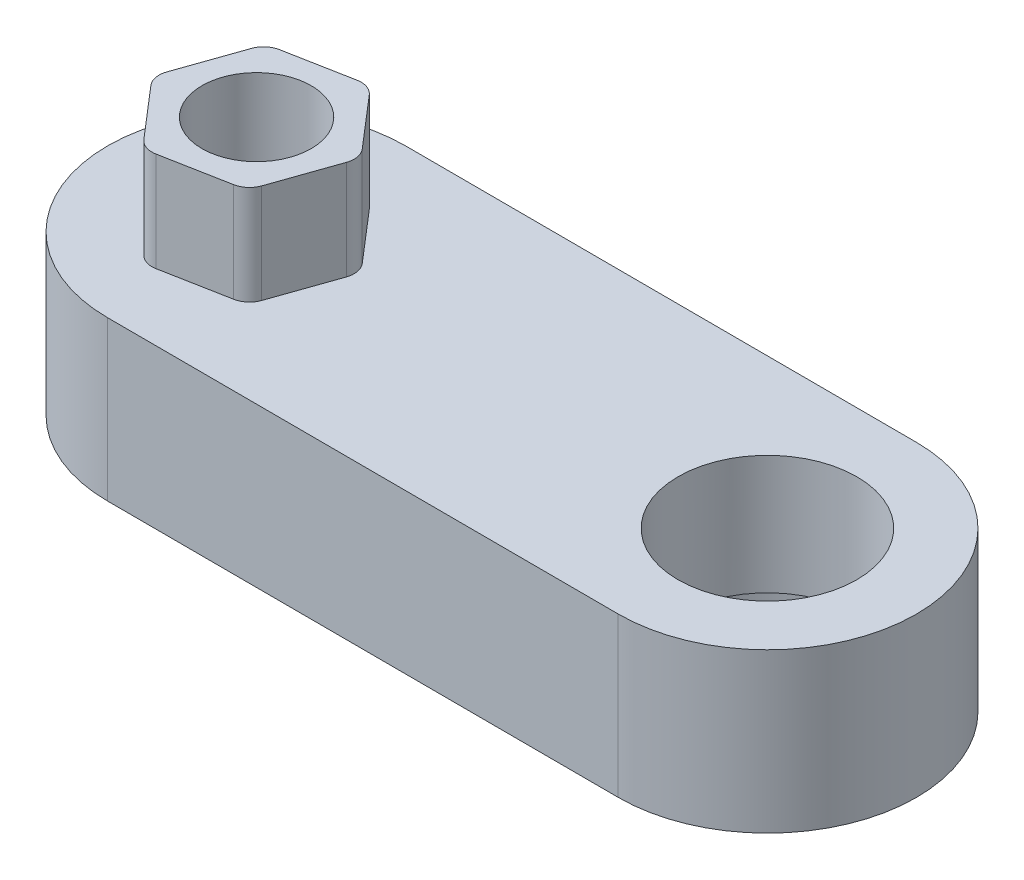
from build123d import *

# Parameters (mm, degrees)
BOSS_EXTRUDE1_DEPTH = 8
BOSS_EXTRUDE2_DEPTH = 5
SKETCH3_R           = 2.75
CUT_EXTRUDE1_DEPTH  = 36.813646862
FILLET1_R           = 1
CUT_EXTRUDE2_DEPTH  = 3
SKETCH5_R           = 6.6
CUT_EXTRUDE3_DEPTH  = 2
SKETCH6_R           = 4.5
CUT_EXTRUDE4_DEPTH  = 36.137121418


with BuildPart() as part:
    # Sketch1 → Boss-Extrude1 (new body)
    with BuildSketch(Plane(origin=(0, 0, 0), x_dir=(1, 0, 0), z_dir=(0, 1, 0))):
        with BuildLine():
            Line((24.015632569, -4.149601491), (-1.78233066, -4.083471877))
            ThreePointArc((-1.78233066, -4.083471877), (-9.26308084, 3.435728662), (-1.743880301, 10.916478842))
            Line((-1.743880301, 10.916478842), (24.054082929, 10.850349227))
            ThreePointArc((24.054082929, 10.850349227), (31.534833108, 3.331148688), (24.015632569, -4.149601491))
        make_face()
    extrude(amount=BOSS_EXTRUDE1_DEPTH)

    # Sketch2 → Boss-Extrude2 (add)
    with BuildSketch(Plane(origin=(0, 8, 0), x_dir=(1, 0, 0), z_dir=(0, 1, 0))):
        Polygon((-3.25175247, -0.833664766), (1.173324698, 0.002213248), (2.661971688, 4.252381497), (-0.274458491, 7.666671731), (-4.69953566, 6.830793717), (-6.188182649, 2.580625468), align=None)
    extrude(amount=BOSS_EXTRUDE2_DEPTH)

    # Sketch3 → Cut-Extrude1 (cut, through all)
    with BuildSketch(Plane(origin=(0, 13, 0), x_dir=(1, 0, 0), z_dir=(0, 1, 0))):
        with Locations(Location((-1.763105481, 3.416503482, 0), (0, 0, 270))):
            Circle(SKETCH3_R)
    extrude(amount=-CUT_EXTRUDE1_DEPTH, mode=Mode.SUBTRACT)

    # Fillet1
    fillet1_edges = [part.edges().sort_by_distance(p)[0] for p in [
        (-6.188182649, 10.5, -2.580625468),
        (-3.25175247, 10.5, 0.833664766),
        (1.173324698, 10.5, -0.002213248),
        (2.661971688, 10.5, -4.252381497),
        (-0.274458491, 10.5, -7.666671731),
        (-4.69953566, 10.5, -6.830793717),
    ]]
    fillet(fillet1_edges, radius=FILLET1_R)

    # Sketch4 → Cut-Extrude2 (cut)
    with BuildSketch(Plane.XZ):
        with BuildLine():
            Line((2.943011006, -3.542205297), (1.836068373, -0.381823779))
            ThreePointArc((1.836068373, -0.381823779), (1.398479703, 0.259582363), (0.698813727, 0.596262041))
            Line((0.698813727, 0.596262041), (-2.59162827, 1.217812359))
            ThreePointArc((-2.59162827, 1.217812359), (-3.365896618, 1.159552526), (-4.00730276, 0.721963855))
            Line((-4.00730276, 0.721963855), (-6.190802123, -1.816867345))
            ThreePointArc((-6.190802123, -1.816867345), (-6.527481801, -2.51653332), (-6.469221968, -3.290801668))
            Line((-6.469221968, -3.290801668), (-5.362279334, -6.451183186))
            ThreePointArc((-5.362279334, -6.451183186), (-4.924690664, -7.092589328), (-4.225024689, -7.429269006))
            Line((-4.225024689, -7.429269006), (-0.934582692, -8.050819324))
            ThreePointArc((-0.934582692, -8.050819324), (-0.160314344, -7.99255949), (0.481091798, -7.55497082))
            Line((0.481091798, -7.55497082), (2.664591162, -5.01613962))
            ThreePointArc((2.664591162, -5.01613962), (3.00127084, -4.316473645), (2.943011006, -3.542205297))
        make_face()
    extrude(amount=-CUT_EXTRUDE2_DEPTH, mode=Mode.SUBTRACT)

    # Sketch5 → Cut-Extrude3 (cut)
    with BuildSketch(Plane.XZ):
        with Locations(Location((24.034857749, -3.350373868, 0), (0, 0, 270))):
            Circle(SKETCH5_R)
    extrude(amount=-CUT_EXTRUDE3_DEPTH, mode=Mode.SUBTRACT)

    # Sketch6 → Cut-Extrude4 (cut, through all)
    with BuildSketch(Plane.XZ.offset(-2)):
        with Locations(Location((24.034857749, -3.350373868, 0), (0, 0, 270))):
            Circle(SKETCH6_R)
    extrude(amount=-CUT_EXTRUDE4_DEPTH, mode=Mode.SUBTRACT)


solid = part.part
